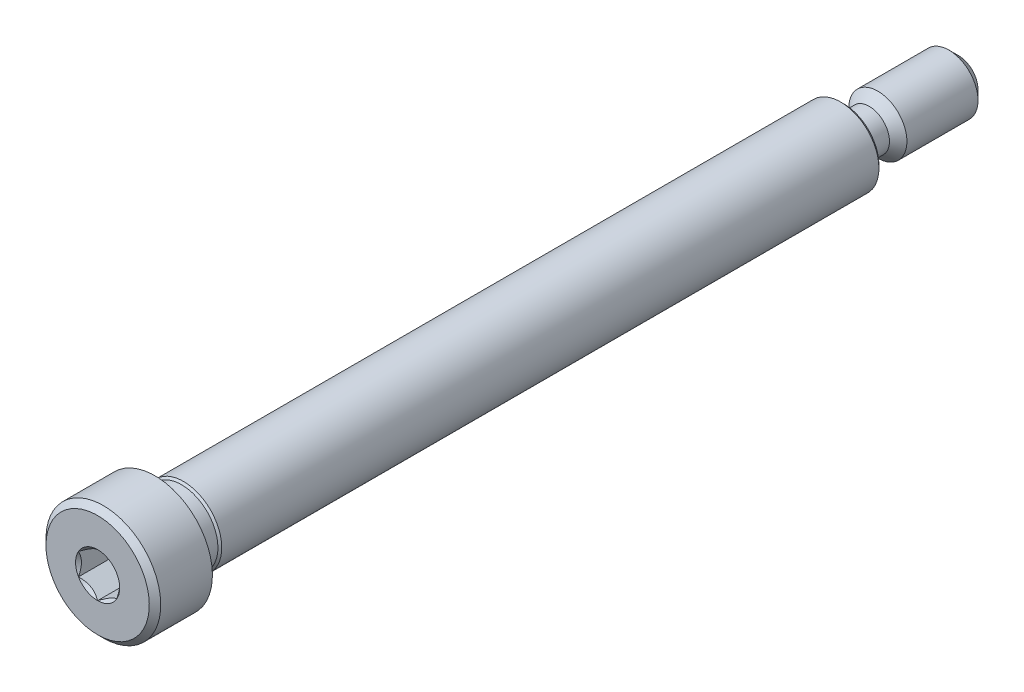
from build123d import *

# Parameters (mm, degrees)
CUT_EXTRUDE1_DEPTH = 3.571875


with BuildPart() as part:
    # Sketch4 → Revolve1 (revolve)
    with BuildSketch(Plane(origin=(0, 0, 0), x_dir=(0, 0, -1), z_dir=(1, 0, 0))):
        Polygon((-30.95625, 4.7625), (-35.2425, 4.7625), (-35.71875, 4.28625), (-35.71875, 0), (26.19375, 0), (26.19375, 2.921), (25.93975, 3.175), (-28.59405, 3.175), (-28.7528, 3.01625), (-30.7975, 3.01625), (-30.95625, 3.175), align=None)
    revolve(axis=Axis((0, 0, 35.71875), (0, 0, -1)))

    # Sketch5 → Cut-Extrude1 (cut)
    with BuildSketch(Plane.XY.offset(35.71875)):
        Polygon((1.5875, 0.916543552), (0, 1.833087105), (-1.5875, 0.916543552), (-1.5875, -0.916543552), (0, -1.833087105), (1.5875, -0.916543552), align=None)
    extrude(amount=-CUT_EXTRUDE1_DEPTH, mode=Mode.SUBTRACT)

    # Cut-Extrude4 cone 1 section (through the dimple's axis) → Cut-Extrude4 (revolve, cut)
    with BuildSketch(Plane(origin=(0, 0, 35.71875), x_dir=(0, -1, 0), z_dir=(1, 0, 0))):
        Polygon((0, 0), (1.833087105, 0), (0, 1.833087105), align=None)
    revolve(axis=Axis((0, 0, 35.71875), (0, 0, -1)), mode=Mode.SUBTRACT)

    # Sketch7 → Revolve2 (revolve)
    with BuildSketch(Plane(origin=(0, 0, 0), x_dir=(0, 0, -1), z_dir=(1, 0, 0))):
        Polygon((26.19375, 2.413), (34.925, 2.413), (35.71875, 1.61925), (35.71875, 0), (26.19375, 0), align=None)
    revolve(axis=Axis((0, 0, -35.71875), (0, 0, 1)))

    # Sketch10 → Cut-Revolve1 (revolve, cut)
    with BuildSketch(Plane(origin=(0, 0, 0), x_dir=(0, 0, -1), z_dir=(1, 0, 0))):
        with BuildLine():
            Line((26.91765, 1.6891), (28.30195, 1.6891))
            Line((28.30195, 1.6891), (29.78785, 3.175))
            Line((29.78785, 3.175), (26.19375, 3.175))
            Line((26.19375, 3.175), (26.19375, 2.413))
            ThreePointArc((26.19375, 2.413), (26.405775401, 1.901125401), (26.91765, 1.6891))
        make_face()
    revolve(axis=Axis((0, 0, -35.71875), (0, 0, 1)), mode=Mode.SUBTRACT)


solid = part.part
